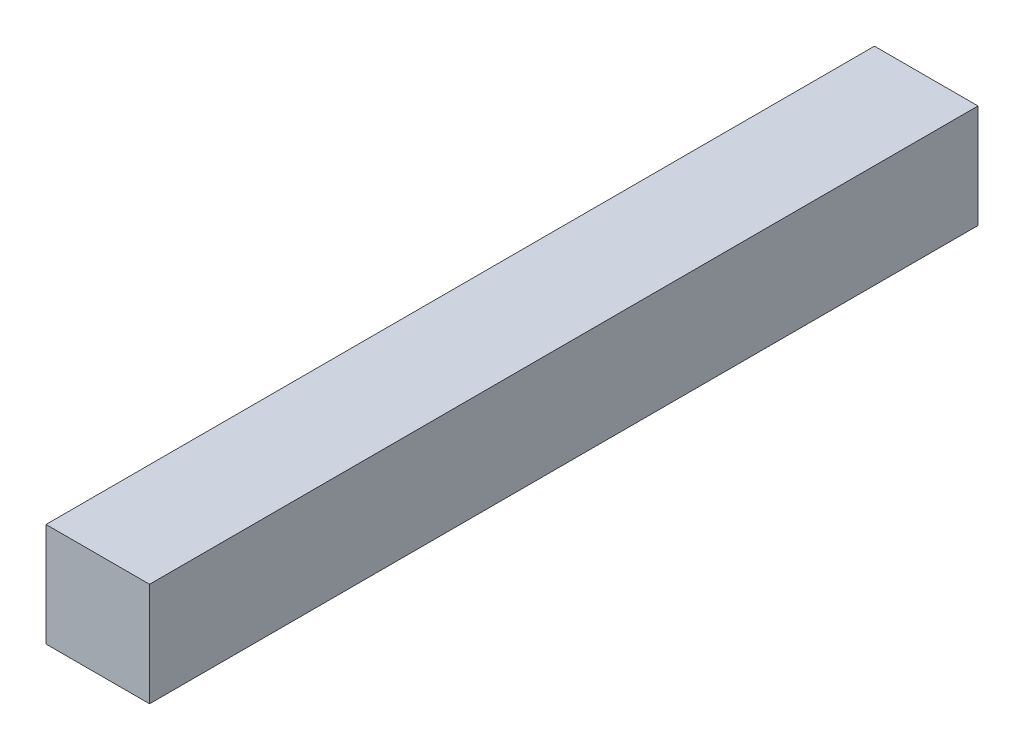
from build123d import *

# Parameters (mm, degrees)
SKETCH1_W      = 25.4
SKETCH1_H      = 25.4
EXTRUDE1_DEPTH = 203.2


with BuildPart() as part:
    # Sketch1 → Extrude1 (new body)
    with BuildSketch(Plane.XY):
        with Locations((12.7, 12.7)):
            Rectangle(SKETCH1_W, SKETCH1_H)
    extrude(amount=EXTRUDE1_DEPTH)


solid = part.part
